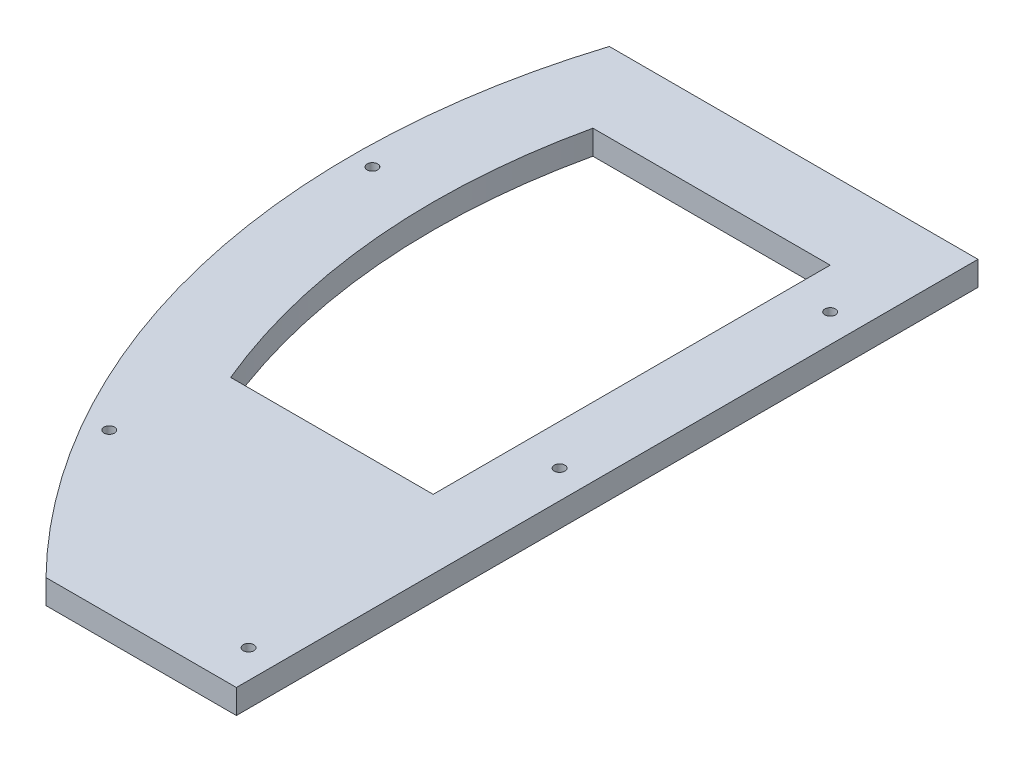
from build123d import *

# Parameters (mm, degrees)
BOSS_EXTRUDE1_DEPTH = 6
SKETCH5_W           = 200
SKETCH5_H           = 20
BOSS_EXTRUDE2_DEPTH = 6
SKETCH6_W           = 86.5
SKETCH6_H           = 143.586884574
BOSS_EXTRUDE3_DEPTH = 6
CUT_EXTRUDE3_DEPTH  = 230.888016217
CUT_EXTRUDE4_DEPTH  = 228.130469114
SKETCH9_W           = 210
SKETCH9_H           = 52
CUT_EXTRUDE5_DEPTH  = 226.140511681
BOSS_EXTRUDE4_DEPTH = 6
FILLET1_R           = 10
SKETCH11_R          = 1.3
CUT_EXTRUDE6_DEPTH  = 259.163707751
SKETCH12_R          = 1.3
CUT_EXTRUDE7_DEPTH  = 259.163707751
SKETCH13_R          = 1.75
CUT_EXTRUDE8_DEPTH  = 10
CUT_EXTRUDE9_DEPTH  = 259.163707751
SKETCH15_R          = 208.652698437
CUT_EXTRUDE10_DEPTH = 259.163707751


with BuildPart() as part:
    # Sketch2 → Boss-Extrude1 (new body)
    with BuildSketch(Plane(origin=(0, 0, 0), x_dir=(1, 0, 0), z_dir=(0, 1, 0))):
        with BuildLine():
            Line((-100, -128.086884574), (-100, 35.5))
            Line((-100, 35.5), (100, 35.5))
            Line((100, 35.5), (100, -128.086884574))
            ThreePointArc((100, -128.086884574), (0, 162.5), (-100, -128.086884574))
        make_face()
    extrude(amount=BOSS_EXTRUDE1_DEPTH)

    # Sketch5 → Boss-Extrude2 (add)
    with BuildSketch(Plane(origin=(0, 6, 0), x_dir=(1, 0, 0), z_dir=(0, 1, 0))):
        with Locations((0, -118.086884574)):
            Rectangle(SKETCH5_W, SKETCH5_H)
    extrude(amount=-BOSS_EXTRUDE2_DEPTH)

    # Sketch6 → Boss-Extrude3 (add, through all)
    with BuildSketch(Plane(origin=(0, 6, 0), x_dir=(1, 0, 0), z_dir=(0, 1, 0))):
        with Locations((-56.75, -36.293442287)):
            Rectangle(SKETCH6_W, SKETCH6_H)
        with Locations((56.75, -36.293442287)):
            Rectangle(SKETCH6_W, SKETCH6_H)
    extrude(amount=-BOSS_EXTRUDE3_DEPTH)

    # Sketch7 → Cut-Extrude3 (cut, through all)
    with BuildSketch(Plane(origin=(0, 6, 0), x_dir=(1, 0, 0), z_dir=(0, 1, 0))):
        with BuildLine():
            Line((-150, -62.5), (-100, -62.5))
            Line((-100, -62.5), (-100, 35.5))
            Line((-100, 35.5), (-158.574903437, 35.5))
            ThreePointArc((-158.574903437, 35.5), (-161.881492944, -14.164471125), (-150, -62.5))
        make_face()
        with BuildLine():
            Line((100, 35.5), (100, -62.5))
            Line((100, -62.5), (150, -62.5))
            ThreePointArc((150, -62.5), (161.881492944, -14.164471125), (158.574903437, 35.5))
            Line((158.574903437, 35.5), (100, 35.5))
        make_face()
    extrude(amount=-CUT_EXTRUDE3_DEPTH, mode=Mode.SUBTRACT)

    # Sketch8 → Cut-Extrude4 (cut, through all)
    with BuildSketch(Plane(origin=(0, 6, 0), x_dir=(1, 0, 0), z_dir=(0, 1, 0))):
        with BuildLine():
            Line((-30, 132.5), (-30, 159.706762537))
            ThreePointArc((-30, 159.706762537), (0, 162.5), (30, 159.706762537))
            Line((30, 159.706762537), (30, 132.5))
            ThreePointArc((30, 132.5), (0, 102.5), (-30, 132.5))
        make_face()
    extrude(amount=-CUT_EXTRUDE4_DEPTH, mode=Mode.SUBTRACT)

    # Sketch9 → Cut-Extrude5 (cut, through all)
    with BuildSketch(Plane(origin=(0, 6, 0), x_dir=(1, 0, 0), z_dir=(0, 1, 0))):
        with Locations((0, 81)):
            Rectangle(SKETCH9_W, SKETCH9_H)
    extrude(amount=-CUT_EXTRUDE5_DEPTH, mode=Mode.SUBTRACT)

    # Sketch10 → Boss-Extrude4 (add, through all)
    with BuildSketch(Plane(origin=(0, 6, 0), x_dir=(1, 0, 0), z_dir=(0, 1, 0))):
        with BuildLine():
            Line((-100, -128.086884574), (-130, -128.086884574))
            ThreePointArc((-130, -128.086884574), (0, 182.5), (130, -128.086884574))
            Line((130, -128.086884574), (100, -128.086884574))
            ThreePointArc((100, -128.086884574), (0, 162.5), (-100, -128.086884574))
        make_face()
    extrude(amount=-BOSS_EXTRUDE4_DEPTH)

    # Fillet1
    fillet1_edges = [part.edges().sort_by_distance(p)[0] for p in [
        (-105, 3, -107),
        (105, 3, -107),
        (105, 3, -55),
        (-105, 3, -55),
    ]]
    fillet(fillet1_edges, radius=FILLET1_R)

    # Sketch11 → Cut-Extrude6 (cut, through all)
    with BuildSketch(Plane(origin=(0, 6, 0), x_dir=(1, 0, 0), z_dir=(0, 1, 0))):
        with Locations(Location((0, 177.5, 0), (0, 0, 270))):
            Circle(SKETCH11_R)
        with Locations(Location((88.75, 153.719509172, 0), (0, 0, 270))):
            Circle(SKETCH11_R)
        with Locations(Location((153.719509172, 88.75, 0), (0, 0, 270))):
            Circle(SKETCH11_R)
        with Locations(Location((177.5, 0, 0), (0, 0, 270))):
            Circle(SKETCH11_R)
        with Locations(Location((153.719509172, -88.75, 0), (0, 0, 270))):
            Circle(SKETCH11_R)
        with Locations((88.75, -153.719509172)):
            Circle(SKETCH11_R)
        with Locations((0, -177.5)):
            Circle(SKETCH11_R)
        with Locations((-88.75, -153.719509172)):
            Circle(SKETCH11_R)
        with Locations(Location((-153.719509172, -88.75, 0), (0, 0, 270))):
            Circle(SKETCH11_R)
        with Locations(Location((-177.5, 0, 0), (0, 0, 270))):
            Circle(SKETCH11_R)
        with Locations(Location((-153.719509172, 88.75, 0), (0, 0, 270))):
            Circle(SKETCH11_R)
        with Locations(Location((-88.75, 153.719509172, 0), (0, 0, 270))):
            Circle(SKETCH11_R)
    extrude(amount=-CUT_EXTRUDE6_DEPTH, mode=Mode.SUBTRACT)

    # Sketch12 → Cut-Extrude7 (cut, through all)
    with BuildSketch(Plane(origin=(0, 6, 0), x_dir=(1, 0, 0), z_dir=(0, 1, 0))):
        with Locations(Location((0, -118.086884574, 0), (0, 0, 270))):
            Circle(SKETCH12_R)
        with Locations(Location((-90, -118.086884574, 0), (0, 0, 270))):
            Circle(SKETCH12_R)
        with Locations(Location((90, -118.086884574, 0), (0, 0, 270))):
            Circle(SKETCH12_R)
        with Locations(Location((-90, 25.5, 0), (0, 0, 270))):
            Circle(SKETCH12_R)
        with Locations(Location((-90, -41.293442287, 0), (0, 0, 270))):
            Circle(SKETCH12_R)
        with Locations(Location((90, -41.293442287, 0), (0, 0, 90))):
            Circle(SKETCH12_R)
        with Locations(Location((90, 25.5, 0), (0, 0, 90))):
            Circle(SKETCH12_R)
    extrude(amount=-CUT_EXTRUDE7_DEPTH, mode=Mode.SUBTRACT)

    # Sketch13 → Cut-Extrude8 (cut)
    with BuildSketch(Plane(origin=(0, 6, 0), x_dir=(1, 0, 0), z_dir=(0, 1, 0))):
        with Locations(Location((-17.875, -13.5, 0), (0, 0, 270))):
            Circle(SKETCH13_R)
        with Locations(Location((17.875, -13.5, 0), (0, 0, 270))):
            Circle(SKETCH13_R)
    extrude(amount=-CUT_EXTRUDE8_DEPTH, mode=Mode.SUBTRACT)

    # Sketch14 → Cut-Extrude9 (cut, through all)
    with BuildSketch(Plane(origin=(0, 6, 0), x_dir=(1, 0, 0), z_dir=(0, 1, 0))):
        with BuildLine():
            Line((-30, 132.5), (30, 132.5))
            ThreePointArc((30, 132.5), (37.46877708, 114.46877708), (55.5, 107))
            Line((55.5, 107), (-55.5, 107))
            ThreePointArc((-55.5, 107), (-37.46877708, 114.46877708), (-30, 132.5))
        make_face()
    extrude(amount=-CUT_EXTRUDE9_DEPTH, mode=Mode.SUBTRACT)

    # Sketch15 → Cut-Extrude10 (cut, through all)
    with BuildSketch(Plane(origin=(0, 6, 0), x_dir=(1, 0, 0), z_dir=(0, 1, 0))):
        Circle(SKETCH15_R)
        with BuildLine():
            Line((-95, 55), (-174.015085553, 55))
            ThreePointArc((-174.015085553, 55), (-177.444343068, -42.658587802), (-130, -128.086884574))
            Line((-130, -128.086884574), (-83, -128.086884574))
            Line((-83, -128.086884574), (-83, 55))
            Line((-83, 55), (-95, 55))
        make_face(mode=Mode.SUBTRACT)
    extrude(amount=-CUT_EXTRUDE10_DEPTH, mode=Mode.SUBTRACT)


solid = part.part
